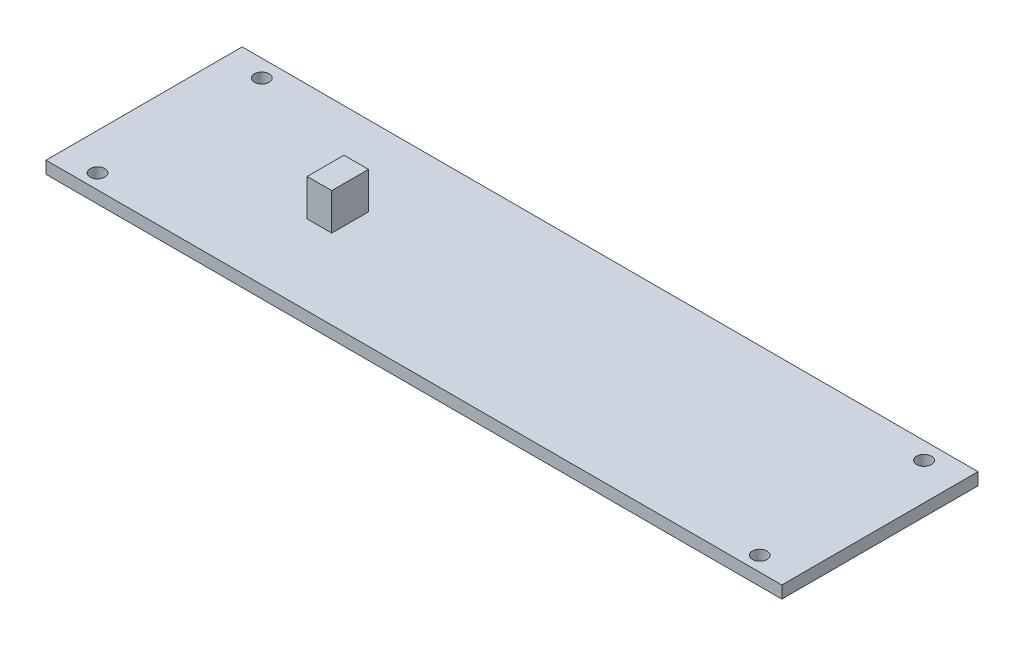
from build123d import *

# Parameters (mm, degrees)
SKETCH1_W           = 300
SKETCH1_H           = 80
BOSS_EXTRUDE1_DEPTH = 5
SKETCH2_R           = 3
CUT_EXTRUDE2_DEPTH  = 5
SKETCH4_W           = 10
SKETCH4_H           = 15
BOSS_EXTRUDE2_DEPTH = 20


with BuildPart() as part:
    # Sketch1 → Boss-Extrude1 (new body)
    with BuildSketch(Plane(origin=(0, 0, 0), x_dir=(1, 0, 0), z_dir=(0, 1, 0))):
        with Locations((150, -40)):
            Rectangle(SKETCH1_W, SKETCH1_H)
    extrude(amount=BOSS_EXTRUDE1_DEPTH)

    # Sketch2 → Cut-Extrude2 (cut)
    with BuildSketch(Plane(origin=(0, 5, 0), x_dir=(1, 0, 0), z_dir=(0, 1, 0))):
        with Locations(Location((15, -7, 0), (0, 0, 270))):
            Circle(SKETCH2_R)
        with Locations(Location((15, -74, 0), (0, 0, 270))):
            Circle(SKETCH2_R)
        with Locations(Location((285, -7, 0), (0, 0, 90))):
            Circle(SKETCH2_R)
        with Locations(Location((285, -74, 0), (0, 0, 90))):
            Circle(SKETCH2_R)
    extrude(amount=-CUT_EXTRUDE2_DEPTH, mode=Mode.SUBTRACT)

    # Sketch4 → Boss-Extrude2 (add)
    with BuildSketch(Plane(origin=(0, 0, 0), x_dir=(1, 0, 0), z_dir=(0, 1, 0))):
        with Locations((79, -40)):
            Rectangle(SKETCH4_W, SKETCH4_H)
    extrude(amount=BOSS_EXTRUDE2_DEPTH)


solid = part.part
